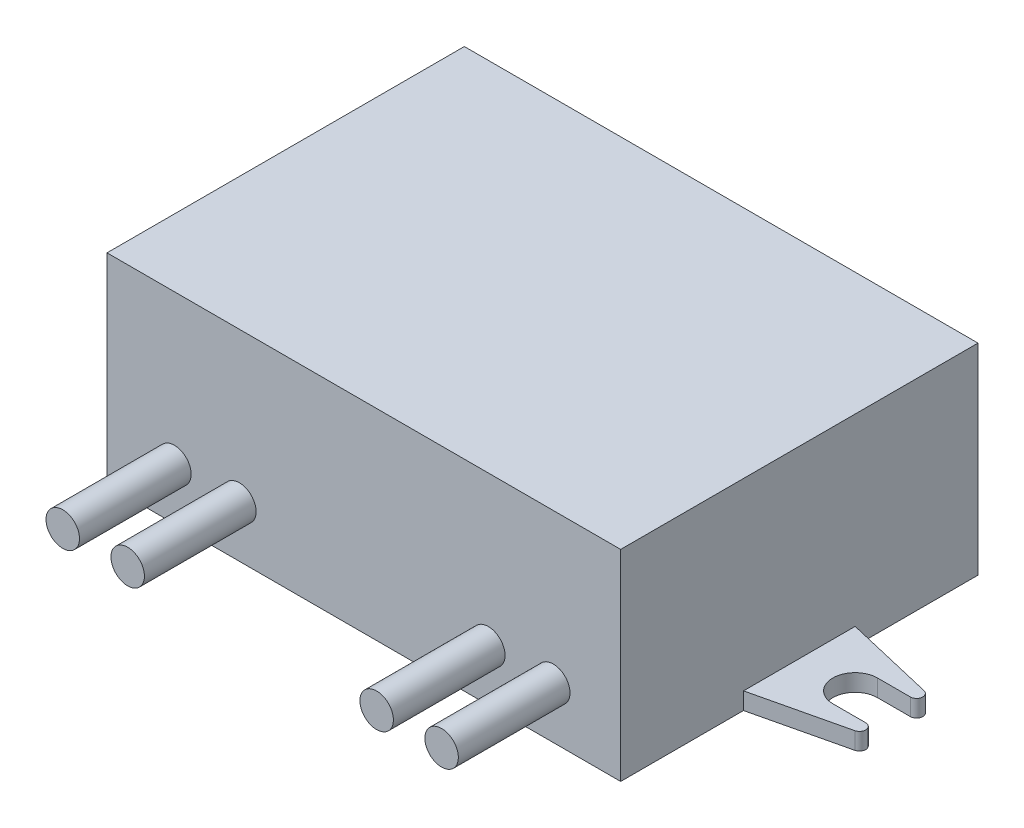
from build123d import *

# Parameters (mm, degrees)
SKETCH_1_W          = 46
SKETCH_1_H          = 32
EXTRUDE_1_DEPTH     = 18
SKETCH_2_W          = 63
SKETCH_2_H          = 1.528020249
EXTRUDE_2_DEPTH     = 32
CUT_EXTRUDE_1_DEPTH = 39.981740814
FILLET_1_R          = 0.558031
FILLET_2_R          = 0.558031
FILLET_3_R          = 0.558031
FILLET_4_R          = 0.558031
SKETCH_5_R          = 1.5
EXTRUDE_3_DEPTH     = 10


with BuildPart() as part:
    # 草图1 → 凸台-拉伸1 (new body)
    with BuildSketch(Plane(origin=(0, 0, 0), x_dir=(1, 0, 0), z_dir=(0, 1, 0))):
        Rectangle(SKETCH_1_W, SKETCH_1_H)
    extrude(amount=EXTRUDE_1_DEPTH)

    # 草图2 → 凸台-拉伸2 (add, through all)
    with BuildSketch(Plane.XY.offset(16)):
        with Locations((0, 0.764010125)):
            Rectangle(SKETCH_2_W, SKETCH_2_H)
    extrude(amount=-EXTRUDE_2_DEPTH)

    # 草图3 → 切除-拉伸1 (cut, through all)
    with BuildSketch(Plane(origin=(0, 1.528020249, 0), x_dir=(1, 0, 0), z_dir=(0, 1, 0))):
        Polygon((-31.5, 16), (-31.5, 3), (-23, 5), (-23, 16), align=None)
        Polygon((-23, -5), (-31.5, -3), (-31.5, -16), (-23, -16), align=None)
        with BuildLine():
            ThreePointArc((-28, -2), (-26, 0), (-28, 2))
            Line((-28, 2), (-31.5, 2))
            Line((-31.5, 2), (-31.5, -2))
            Line((-31.5, -2), (-28, -2))
        make_face()
    cut_extrude_1 = extrude(amount=-CUT_EXTRUDE_1_DEPTH, mode=Mode.SUBTRACT)

    # 圆角1
    fillet_1_edges = [part.edges().sort_by_distance(p)[0] for p in [
        (-31.5, 0.764010125, -3),
        (-31.5, 0.764010125, -2),
    ]]
    fillet(fillet_1_edges, radius=FILLET_1_R)

    # 圆角2
    fillet_2_edges = [part.edges().sort_by_distance(p)[0] for p in [
        (-31.5, 0.764010125, 3),
        (-31.5, 0.764010125, 2),
    ]]
    fillet(fillet_2_edges, radius=FILLET_2_R)

    # 镜向4: 切除-拉伸1 across plane
    add(cut_extrude_1.mirror(Plane(origin=(0, 0, 0), x_dir=(0, 0, 1), z_dir=(1, 0, 0))), mode=Mode.SUBTRACT)

    # 圆角3
    fillet_3_edges = [part.edges().sort_by_distance(p)[0] for p in [
        (31.5, 0.764010125, -3),
        (31.5, 0.764010125, -2),
    ]]
    fillet(fillet_3_edges, radius=FILLET_3_R)

    # 圆角4
    fillet_4_edges = [part.edges().sort_by_distance(p)[0] for p in [
        (31.5, 0.764010125, 3),
        (31.5, 0.764010125, 2),
    ]]
    fillet(fillet_4_edges, radius=FILLET_4_R)

    # 草图5 → 凸台-拉伸3 (add)
    with BuildSketch(Plane.XY.offset(16)):
        with Locations(Location((-16.963649323, 4.593857319, 0), (0, 0, 180))):
            Circle(SKETCH_5_R)
        with Locations(Location((-11.147540984, 4.593857319, 0), (0, 0, 180))):
            Circle(SKETCH_5_R)
        with Locations(Location((11.147540984, 4.593857319, 0), (0, 0, 180))):
            Circle(SKETCH_5_R)
        with Locations(Location((16.963649323, 4.593857319, 0), (0, 0, 180))):
            Circle(SKETCH_5_R)
    extrude(amount=EXTRUDE_3_DEPTH)


solid = part.part
